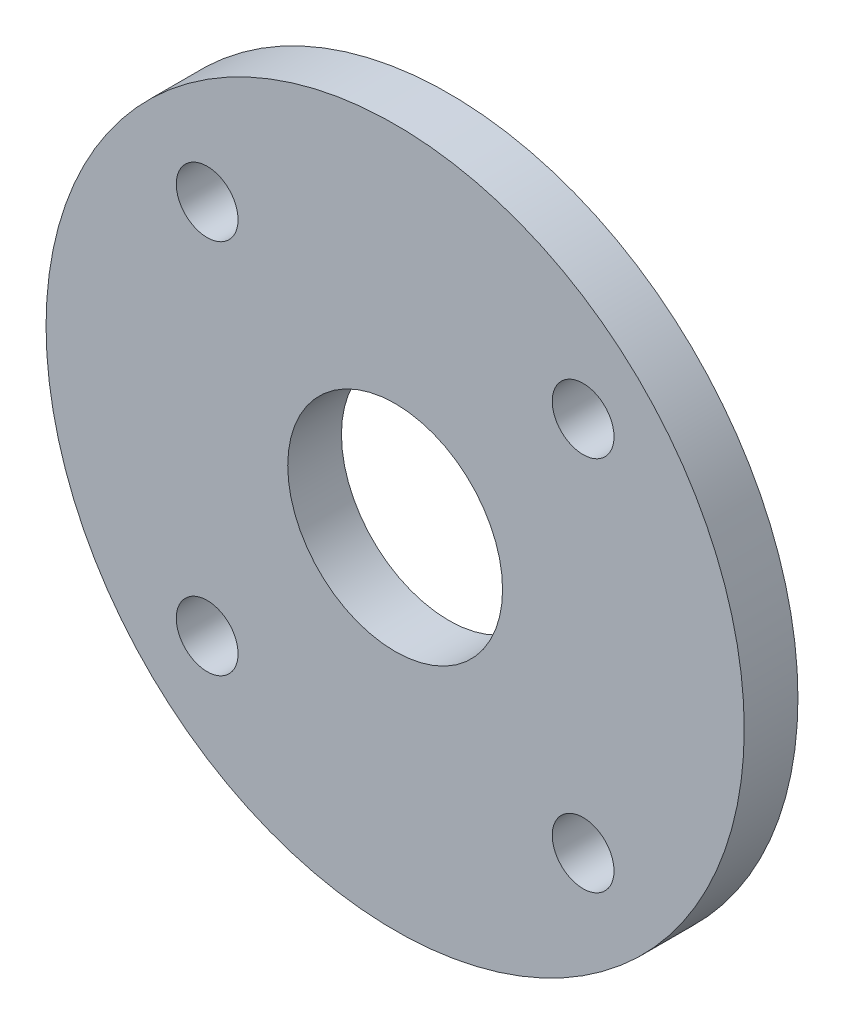
from build123d import *

# Parameters (mm, degrees)
CAP_OD26_ID8_THICKNESS2_PROFILE_R   = 13
CAP_OD26_ID8_THICKNESS2_PROFILE_R_2 = 4
CAP_OD26_ID8_THICKNESS2_DEPTH       = 2
FOUR_M2_CAPTURE_HOLES_START         = -50
FOUR_M2_CAPTURE_HOLES_PROFILE_R     = 1.15
FOUR_M2_CAPTURE_HOLES_DEPTH         = 69.493242009
LOW_PROFILE_HEAD_SEATS_R            = 2.1
HEAD_RECESS_DEPTH0P35_DEPTH         = 0.35


with BuildPart() as part:
    # Cap_OD26_ID8_thickness2_profile → Cap_OD26_ID8_thickness2 (new body)
    with BuildSketch(Plane.XY):
        Circle(CAP_OD26_ID8_THICKNESS2_PROFILE_R)
        Circle(CAP_OD26_ID8_THICKNESS2_PROFILE_R_2, mode=Mode.SUBTRACT)
    extrude(amount=CAP_OD26_ID8_THICKNESS2_DEPTH)

    # Four_M2_capture_holes_profile → Four_M2_capture_holes (cut, through all)
    with BuildSketch(Plane.XY.offset(FOUR_M2_CAPTURE_HOLES_START)):
        with Locations((7, 7)):
            Circle(FOUR_M2_CAPTURE_HOLES_PROFILE_R)
        with Locations((-7, 7)):
            Circle(FOUR_M2_CAPTURE_HOLES_PROFILE_R)
        with Locations((-7, -7)):
            Circle(FOUR_M2_CAPTURE_HOLES_PROFILE_R)
        with Locations((7, -7)):
            Circle(FOUR_M2_CAPTURE_HOLES_PROFILE_R)
    extrude(amount=FOUR_M2_CAPTURE_HOLES_DEPTH, mode=Mode.SUBTRACT)

    # Low_profile_head_seats → Head_recess_depth0p35 (cut)
    with BuildSketch(Plane.XY):
        with Locations((7, 7)):
            Circle(LOW_PROFILE_HEAD_SEATS_R)
        with Locations((-7, 7)):
            Circle(LOW_PROFILE_HEAD_SEATS_R)
        with Locations((-7, -7)):
            Circle(LOW_PROFILE_HEAD_SEATS_R)
        with Locations((7, -7)):
            Circle(LOW_PROFILE_HEAD_SEATS_R)
    extrude(amount=HEAD_RECESS_DEPTH0P35_DEPTH, mode=Mode.SUBTRACT)


solid = part.part
